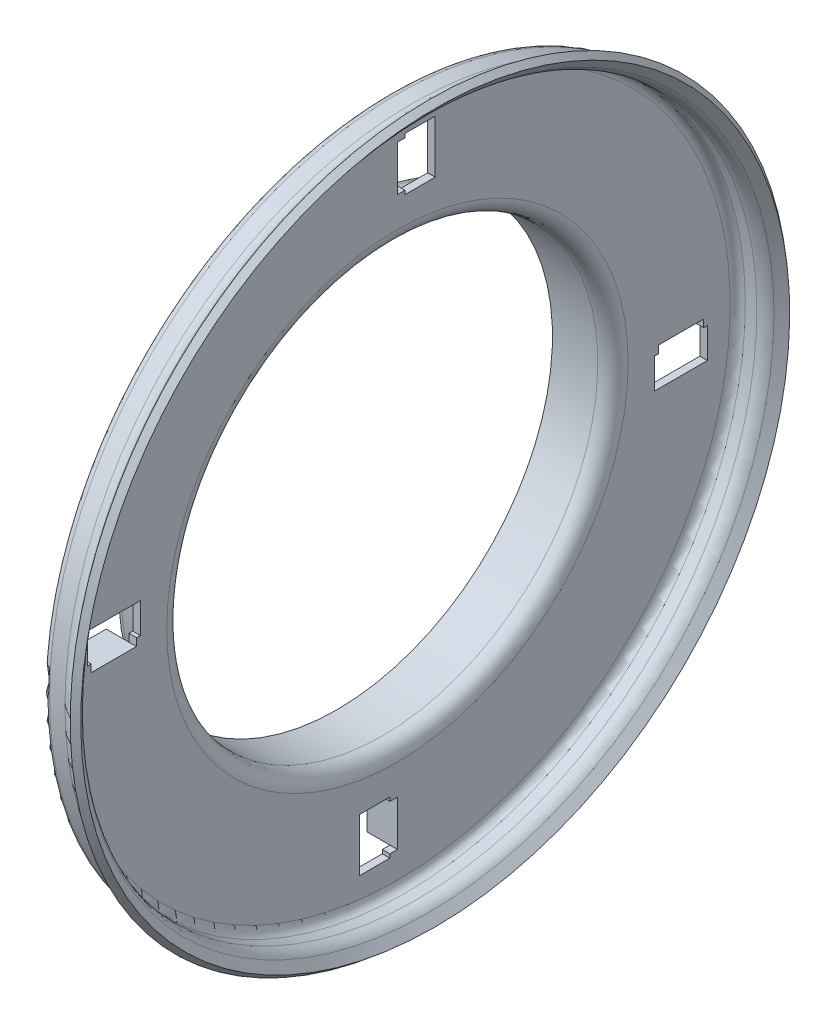
from build123d import *

# Parameters (mm, degrees)
CUT_EXTRUDE_1_DEPTH = 68.649833703
EXTRUDE_1_DEPTH     = 3


with BuildPart() as part:
    # 草图1 → 旋转1 (revolve)
    with BuildSketch(Plane.XY):
        with BuildLine():
            Line((-38.083747267, -28.5), (-32.083747267, -28.5))
            ThreePointArc((-32.083747267, -28.5), (-30.669533704, -29.085786438), (-30.083747267, -30.5))
            Line((-30.083747267, -30.5), (-30.083747267, -44))
            ThreePointArc((-30.083747267, -44), (-29.790854048, -44.707106781), (-29.083747267, -45))
            Line((-29.083747267, -45), (-27.565467955, -45))
            ThreePointArc((-27.565467955, -45), (-26.713721936, -45.190434107), (-26.02417741, -45.72547128))
            Line((-26.02417741, -45.72547128), (-25.083747267, -46.86273564))
            Line((-25.083747267, -46.86273564), (-25.854392539, -47.5))
            Line((-25.854392539, -47.5), (-26.494868211, -46.72547128))
            ThreePointArc((-26.494868211, -46.72547128), (-27.184412737, -46.190434107), (-28.036158755, -46))
            Line((-28.036158755, -46), (-30.083747267, -46))
            ThreePointArc((-30.083747267, -46), (-30.790854048, -45.707106781), (-31.083747267, -45))
            Line((-31.083747267, -45), (-31.083747267, -31.5))
            ThreePointArc((-31.083747267, -31.5), (-31.669533704, -30.085786438), (-33.083747267, -29.5))
            Line((-33.083747267, -29.5), (-37.083747267, -29.5))
            ThreePointArc((-37.083747267, -29.5), (-37.790854048, -29.207106781), (-38.083747267, -28.5))
        make_face()
    revolve(axis=Axis((-28.083747267, 0, 0), (1, 0, 0)))

    # 草图3 → 切除-拉伸1 (cut, through all)
    with BuildSketch(Plane(origin=(-30.083747267, 0, 0), x_dir=(0, 0, -1), z_dir=(1, 0, 0))):
        Polygon((0, -34.5), (-1, -34.485504201), (-1, -33.985504201), (-5, -33.985504201), (-5, -40.985504201), (-1, -40.985504201), (-1, -40.485504201), (0, -40.485504201), align=None)
        Polygon((-33.985504201, 1), (-33.985504201, 5), (-40.985504201, 5), (-40.985504201, 1), (-40.485504201, 1), (-40.485504201, 0), (-34.5, 0), (-34.485504201, 1), align=None)
        Polygon((1, 33.985504201), (5, 33.985504201), (5, 40.985504201), (1, 40.985504201), (1, 40.485504201), (0, 40.485504201), (0, 34.5), (1, 34.485504201), align=None)
        Polygon((33.985504201, -1), (33.985504201, -5), (40.985504201, -5), (40.985504201, -1), (40.485504201, -1), (40.485504201, 0), (34.5, 0), (34.485504201, -1), align=None)
    extrude(amount=-CUT_EXTRUDE_1_DEPTH, mode=Mode.SUBTRACT)

    # 草图4 → 凸台-拉伸1 (add)
    with BuildSketch(Plane.ZY.offset(31.083747267)):
        Polygon((0, 40.485504201), (1, 40.485504201), (1, 34.485504201), (0, 34.5), align=None)
        Polygon((34.485504201, -1), (34.5, 0), (40.485504201, 0), (40.485504201, -1), align=None)
        Polygon((-1, -34.485504201), (0, -34.5), (0, -40.485504201), (-1, -40.485504201), align=None)
        Polygon((-34.485504201, 1), (-34.5, 0), (-40.485504201, 0), (-40.485504201, 1), align=None)
    extrude(amount=EXTRUDE_1_DEPTH)


solid = part.part
